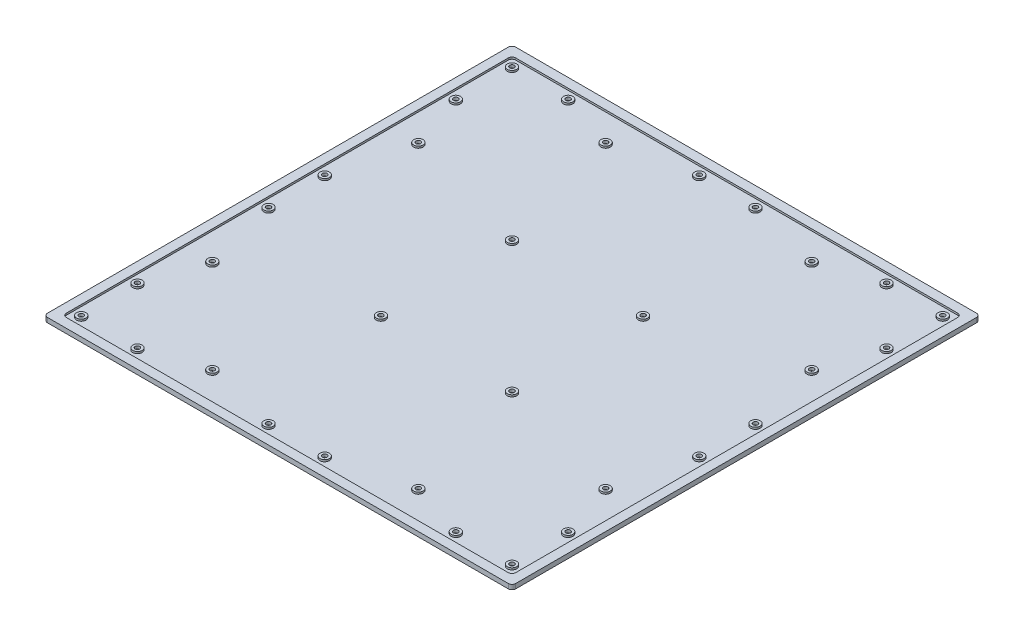
from build123d import *

# Parameters (mm, degrees)
SKETCH1_W                       = 250
SKETCH1_H                       = 250
BOSS_EXTRUDE1_DEPTH             = 1.25
SKETCH2_W                       = 240
SKETCH2_H                       = 240
CUT_EXTRUDE1_DEPTH              = 1
SKETCH3_R                       = 2.5
BOSS_EXTRUDE2_DEPTH             = 1
FILLET1_R                       = 2
TAP_DRILL_FOR_M3X0_5_TAP1_D     = 2.5
TAP_DRILL_FOR_M3X0_5_TAP1_DEPTH = 1.5
TAP_DRILL_FOR_M3X0_5_TAP1_TIP   = 0.751075774


with BuildPart() as part:
    # Sketch1 → Boss-Extrude1 (new, symmetric)
    with BuildSketch(Plane(origin=(0, 0, 0), x_dir=(1, 0, 0), z_dir=(0, 1, 0))):
        Rectangle(SKETCH1_W, SKETCH1_H)
    extrude(amount=BOSS_EXTRUDE1_DEPTH, both=True)

    # Sketch2 → Cut-Extrude1 (cut)
    with BuildSketch(Plane(origin=(0, 1.25, 0), x_dir=(1, 0, 0), z_dir=(0, 1, 0))):
        Rectangle(SKETCH2_W, SKETCH2_H)
    extrude(amount=-CUT_EXTRUDE1_DEPTH, mode=Mode.SUBTRACT)

    # Sketch3 → Boss-Extrude2 (add)
    with BuildSketch(Plane(origin=(0, 0.25, 0), x_dir=(1, 0, 0), z_dir=(0, 1, 0))):
        with Locations(Location((-115, -115, 0), (0, 0, 90))):
            Circle(SKETCH3_R)
        with Locations(Location((-85, -115, 0), (0, 0, 90))):
            Circle(SKETCH3_R)
        with Locations(Location((-55, -105, 0), (0, 0, 90))):
            Circle(SKETCH3_R)
        with Locations(Location((-15, -115, 0), (0, 0, 90))):
            Circle(SKETCH3_R)
        with Locations(Location((15, -115, 0), (0, 0, 90))):
            Circle(SKETCH3_R)
        with Locations(Location((55, -105, 0), (0, 0, 90))):
            Circle(SKETCH3_R)
        with Locations(Location((85, -115, 0), (0, 0, 90))):
            Circle(SKETCH3_R)
        with Locations(Location((-115, 115, 0), (0, 0, 90))):
            Circle(SKETCH3_R)
        with Locations(Location((-115, 85, 0), (0, 0, 90))):
            Circle(SKETCH3_R)
        with Locations(Location((-105, 55, 0), (0, 0, 90))):
            Circle(SKETCH3_R)
        with Locations(Location((-115, 15, 0), (0, 0, 90))):
            Circle(SKETCH3_R)
        with Locations(Location((-115, -15, 0), (0, 0, 90))):
            Circle(SKETCH3_R)
        with Locations(Location((-105, -55, 0), (0, 0, 90))):
            Circle(SKETCH3_R)
        with Locations(Location((-115, -85, 0), (0, 0, 90))):
            Circle(SKETCH3_R)
        with Locations(Location((115, 115, 0), (0, 0, 90))):
            Circle(SKETCH3_R)
        with Locations(Location((85, 115, 0), (0, 0, 90))):
            Circle(SKETCH3_R)
        with Locations(Location((55, 105, 0), (0, 0, 90))):
            Circle(SKETCH3_R)
        with Locations(Location((15, 115, 0), (0, 0, 90))):
            Circle(SKETCH3_R)
        with Locations(Location((-15, 115, 0), (0, 0, 90))):
            Circle(SKETCH3_R)
        with Locations(Location((-55, 105, 0), (0, 0, 90))):
            Circle(SKETCH3_R)
        with Locations(Location((-85, 115, 0), (0, 0, 90))):
            Circle(SKETCH3_R)
        with Locations(Location((115, -115, 0), (0, 0, 90))):
            Circle(SKETCH3_R)
        with Locations(Location((115, -85, 0), (0, 0, 90))):
            Circle(SKETCH3_R)
        with Locations(Location((105, -55, 0), (0, 0, 90))):
            Circle(SKETCH3_R)
        with Locations(Location((115, -15, 0), (0, 0, 90))):
            Circle(SKETCH3_R)
        with Locations(Location((115, 15, 0), (0, 0, 90))):
            Circle(SKETCH3_R)
        with Locations(Location((105, 55, 0), (0, 0, 90))):
            Circle(SKETCH3_R)
        with Locations(Location((115, 85, 0), (0, 0, 90))):
            Circle(SKETCH3_R)
        with Locations(Location((-35, 35, 0), (0, 0, 90))):
            Circle(SKETCH3_R)
        with Locations(Location((-35, -35, 0), (0, 0, 90))):
            Circle(SKETCH3_R)
        with Locations(Location((35, -35, 0), (0, 0, 90))):
            Circle(SKETCH3_R)
        with Locations(Location((35, 35, 0), (0, 0, 90))):
            Circle(SKETCH3_R)
    extrude(amount=BOSS_EXTRUDE2_DEPTH)

    # Fillet1
    fillet1_edges = [part.edges().sort_by_distance(p)[0] for p in [
        (120, 0.75, -120),
        (120, 0.75, 120),
        (-120, 0.75, 120),
        (-120, 0.75, -120),
        (125, 0, 125),
        (-125, 0, 125),
        (-125, 0, -125),
        (125, 0, -125),
    ]]
    fillet(fillet1_edges, radius=FILLET1_R)

    # Tap Drill for M3x0.5 Tap1
    with Locations(Plane(origin=(-115, 1.25, 115), x_dir=(0, 0, 1), z_dir=(0, 1, 0))):
        with Locations((0, 0), (0, 30), (-30, 0), (-60, 10), (-100, 0), (-130, 0), (-200, 0), (-170, 10), (-230, 0), (-230, 30), (-220, 60), (-230, 100), (-230, 130), (-150, 80), (-150, 150), (-10, 60), (-80, 80), (-80, 150), (0, 100), (0, 130), (-10, 170), (0, 200), (0, 230), (-30, 230), (-60, 220), (-100, 230), (-130, 230), (-170, 220), (-220, 170), (-230, 200), (-230, 230), (-200, 230)):
            Hole(TAP_DRILL_FOR_M3X0_5_TAP1_D / 2, depth=TAP_DRILL_FOR_M3X0_5_TAP1_DEPTH)
            with Locations((0, 0, -(TAP_DRILL_FOR_M3X0_5_TAP1_DEPTH + TAP_DRILL_FOR_M3X0_5_TAP1_TIP / 2))):  # 118° drill point
                Cone(0, TAP_DRILL_FOR_M3X0_5_TAP1_D / 2, TAP_DRILL_FOR_M3X0_5_TAP1_TIP, mode=Mode.SUBTRACT)


solid = part.part
